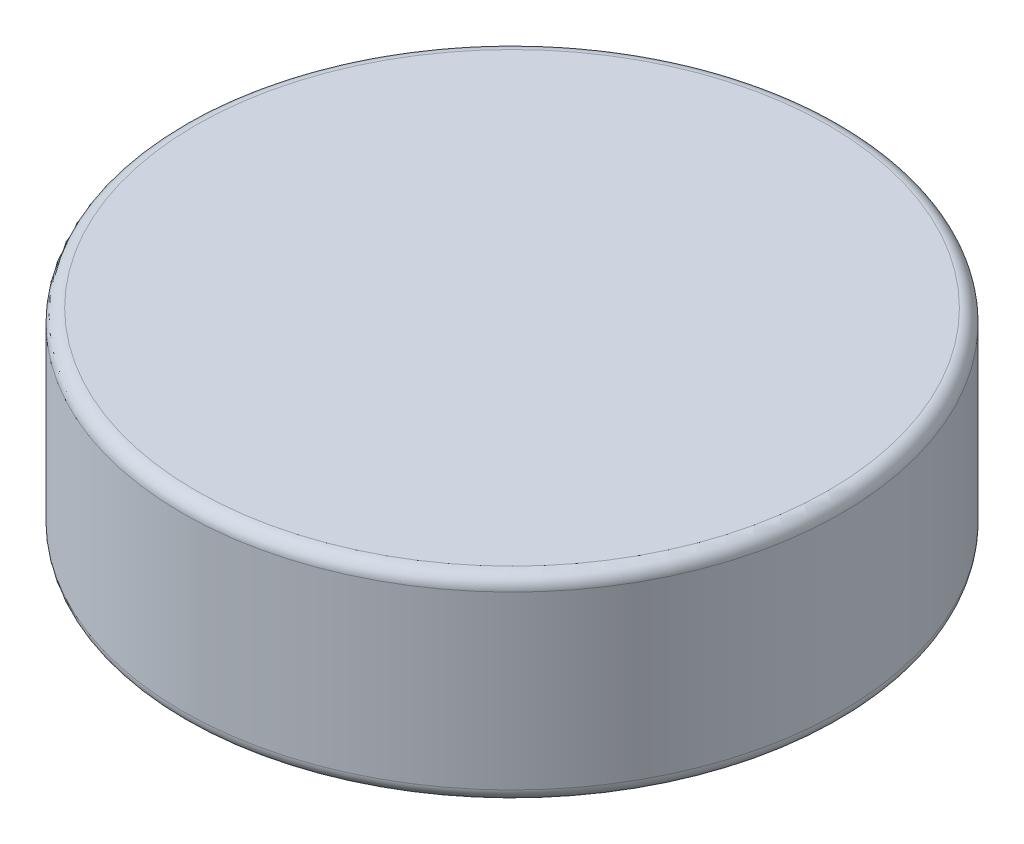
from build123d import *

# Parameters (mm, degrees)
SKETCH1_R           = 5
BOSS_EXTRUDE1_DEPTH = 1.5
FILLET1_R           = 0.2


with BuildPart() as part:
    # Sketch1 → Boss-Extrude1 (new, symmetric)
    with BuildSketch(Plane(origin=(0, 0, 0), x_dir=(1, 0, 0), z_dir=(0, 1, 0))):
        with Locations(Location((0, 0, 0), (0, 0, 270))):
            Circle(SKETCH1_R)
    extrude(amount=BOSS_EXTRUDE1_DEPTH, both=True)

    # Fillet1
    fillet1_edges = [part.edges().sort_by_distance(p)[0] for p in [
        (0, -1.5, -5),
        (0, 1.5, -5),
    ]]
    fillet(fillet1_edges, radius=FILLET1_R)


solid = part.part
